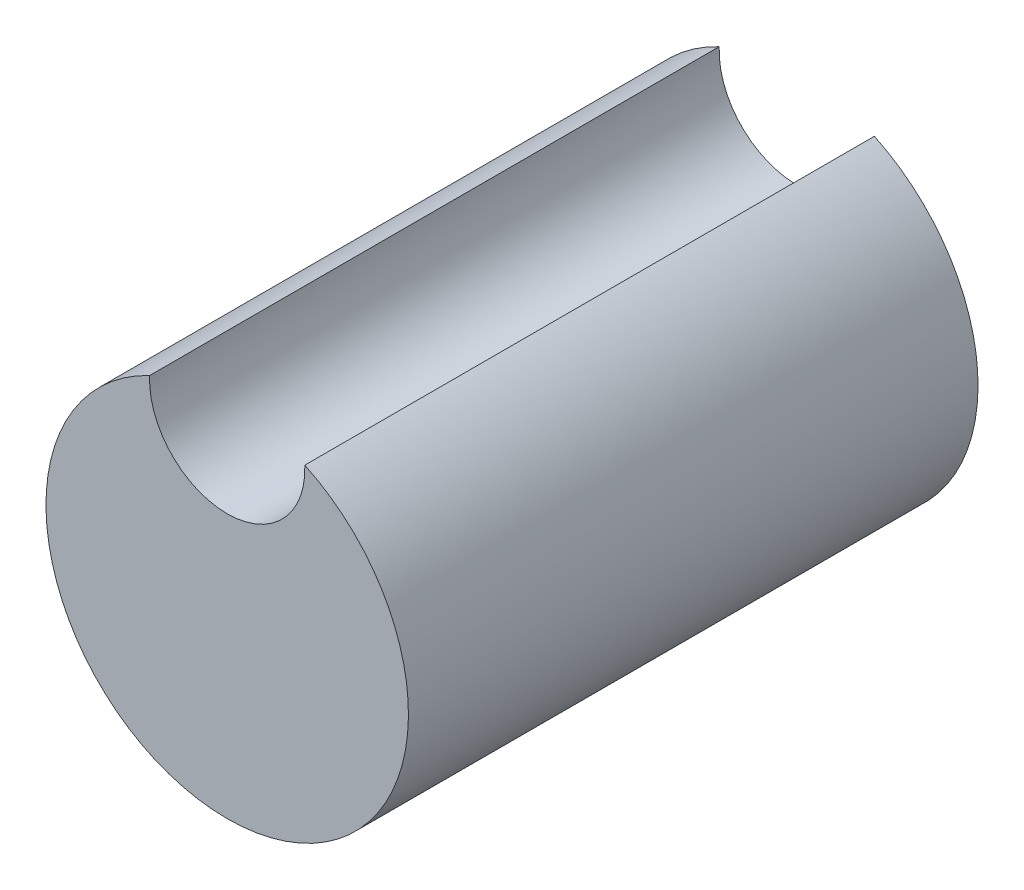
from build123d import *

# Parameters (mm, degrees)
ESQUISSE3_R      = 17.5
EXTRUSION2_DEPTH = 55
EXTRUSION4_REACH = 62.312
ESQUISSE4_R      = 7.5


with BuildPart() as part:
    # Esquisse3 → Extrusion2 (new body)
    with BuildSketch(Plane.XY):
        Circle(ESQUISSE3_R)
    extrude(amount=EXTRUSION2_DEPTH)

    # Esquisse4 → Extrusion4 (cut, up to next)
    with BuildSketch(Plane.XY.offset(55), mode=Mode.PRIVATE) as extrusion4_sk1:
        with Locations((0, 15.5)):
            Circle(ESQUISSE4_R)
    extrusion4_tool1 = extrude(extrusion4_sk1.sketch, amount=-EXTRUSION4_REACH, mode=Mode.PRIVATE) & part.part
    add(extrusion4_tool1.solids().sort_by_distance((0, 15.5, 55))[0], mode=Mode.SUBTRACT)


solid = part.part
